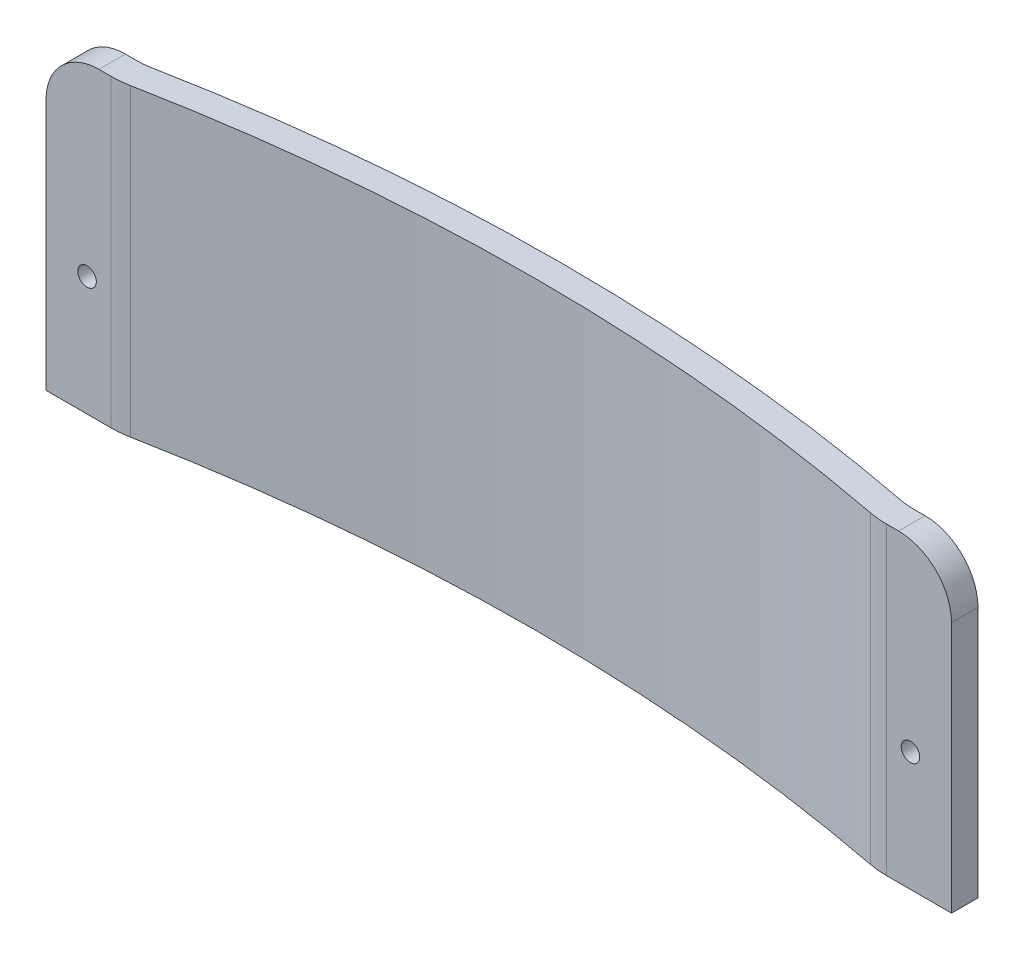
from build123d import *

# Parameters (mm, degrees)
EXTRUDE_1_DEPTH     = 115
SKETCH_4_R          = 3.5
CUT_EXTRUDE_2_DEPTH = 208.464142308
FILLET_1_R          = 20


with BuildPart() as part:
    # Эскиз1 → Вытянуть-Тонкостенный1 (new body)
    with BuildSketch(Plane(origin=(0, 0, 0), x_dir=(1, 0, 0), z_dir=(0, 1, 0))):
        with BuildLine():
            Line((-171, 0), (-146.383337508, 0))
            ThreePointArc((-146.383337508, 0), (-143.05426157, 0.158684678), (-139.755372679, 0.633299806))
            ThreePointArc((-139.755372679, 0.633299806), (0, 13.986878572), (139.755372679, 0.633299806))
            ThreePointArc((139.755372679, 0.633299806), (143.05426157, 0.158684678), (146.383337508, 0))
            Line((146.383337508, 0), (171, 0))
            Line((171, 0), (171, 10))
            Line((171, 10), (146.383337508, 10))
            ThreePointArc((146.383337508, 10), (144.005426124, 10.113346198), (141.649076916, 10.452357004))
            ThreePointArc((141.649076916, 10.452357004), (0, 23.986878572), (-141.649076916, 10.452357004))
            ThreePointArc((-141.649076916, 10.452357004), (-144.005426124, 10.113346198), (-146.383337508, 10))
            Line((-146.383337508, 10), (-171, 10))
            Line((-171, 10), (-171, 0))
        make_face()
    extrude(amount=EXTRUDE_1_DEPTH)

    # Эскиз4 → Вырез-Вытянуть2 (cut, through all)
    with BuildSketch(Plane.XY):
        with Locations((-155.5, 45)):
            Circle(SKETCH_4_R)
        with Locations((155.5, 45)):
            Circle(SKETCH_4_R)
    extrude(amount=-CUT_EXTRUDE_2_DEPTH, mode=Mode.SUBTRACT)

    # Скругление1
    fillet_1_edges = [part.edges().sort_by_distance(p)[0] for p in [
        (171, 115, -5),
        (-171, 115, -5),
    ]]
    fillet(fillet_1_edges, radius=FILLET_1_R)


solid = part.part
